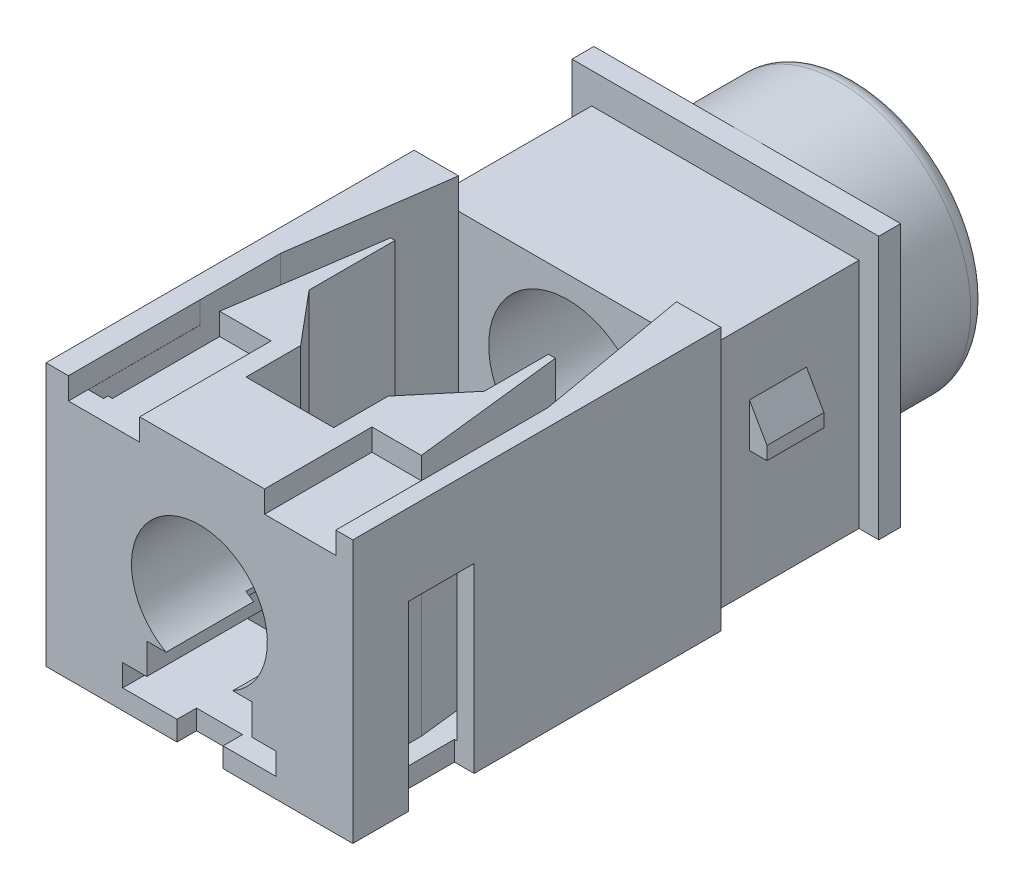
from build123d import *

# Parameters (mm, degrees)
SZKIC1_R                      = 3
SZKIC1_R_2                    = 1.8
DODANIE_WYCI_GNI_CIE1_DEPTH   = 2.5
SZKIC2_W                      = 7
SZKIC2_H                      = 6
SZKIC2_R                      = 1.8
DODANIE_WYCI_GNI_CIE2_DEPTH   = 0.5
ZAOKR_GLENIE1_R               = 0.4
SFAZOWANIE1_SIZE              = 0.4
SZKIC3_W                      = 6.1
SZKIC3_H                      = 5.3
SZKIC3_R                      = 1.8
DODANIE_WYCI_GNI_CIE3_DEPTH   = 3.6
DODANIE_WYCI_GNI_CIE4_START   = -0.1
DODANIE_WYCI_GNI_CIE4_DEPTH   = 1.3
SZKIC5_W                      = 7
SZKIC5_H                      = 6
SZKIC5_R                      = 1.55
DODANIE_WYCI_GNI_CIE5_DEPTH   = 8.4
SZKIC8_R                      = 0.475
DODANIE_WYCI_GNI_CIE6_DEPTH   = 0.8
DODANIE_WYCI_GNI_CIE6_2_DEPTH = 0.8
ZAOKR_GLENIE2_R               = 0.2
ZAOKR_GLENIE3_R               = 0.2
SZKIC9_W                      = 0.85
SZKIC9_H                      = 1.15
WYTNIJ_WYCI_GNI_CIE1_DEPTH    = 0.95
SZKIC10_W                     = 1.05
SZKIC10_H                     = 0.475
WYTNIJ_WYCI_GNI_CIE2_DEPTH    = 2
WYTNIJ_WYCI_GNI_CIE3_DEPTH    = 4.15
WYTNIJ_WYCI_GNI_CIE4_START    = -8.4
WYTNIJ_WYCI_GNI_CIE4_DEPTH    = 8.4
WYTNIJ_WYCI_GNI_CIE5_REACH    = 18.837
SZKIC14_W                     = 1.625
SZKIC14_H                     = 2.45
SZKIC14_H_2                   = 3
WYTNIJ_WYCI_GNI_CIE6_DEPTH    = 0.5


with BuildPart() as part:
    # Szkic1 → Dodanie-wyciągnięcie1 (new body)
    with BuildSketch(Plane.XY):
        Circle(SZKIC1_R)
        Circle(SZKIC1_R_2, mode=Mode.SUBTRACT)
    extrude(amount=DODANIE_WYCI_GNI_CIE1_DEPTH)

    # Szkic2 → Dodanie-wyciągnięcie2 (add)
    with BuildSketch(Plane.XY.offset(2.5)):
        Rectangle(SZKIC2_W, SZKIC2_H)
        Circle(SZKIC2_R, mode=Mode.SUBTRACT)
    extrude(amount=DODANIE_WYCI_GNI_CIE2_DEPTH)

    # Zaokrąglenie1
    zaokr_glenie1_edges = [part.edges().sort_by_distance(p)[0] for p in [
        (-3, 0, 0),
    ]]
    fillet(zaokr_glenie1_edges, radius=ZAOKR_GLENIE1_R)

    # Sfazowanie1
    sfazowanie1_edges = [part.edges().sort_by_distance(p)[0] for p in [
        (-1.8, 0, 0),
    ]]
    chamfer(sfazowanie1_edges, length=SFAZOWANIE1_SIZE)

    # Szkic3 → Dodanie-wyciągnięcie3 (add)
    with BuildSketch(Plane.XY.offset(3)):
        with Locations((0, -0.35)):
            Rectangle(SZKIC3_W, SZKIC3_H)
        Circle(SZKIC3_R, mode=Mode.SUBTRACT)
    extrude(amount=DODANIE_WYCI_GNI_CIE3_DEPTH)


with BuildPart() as body_2:
    # Szkic4 → Dodanie-wyciągnięcie4 (new body)
    with BuildSketch(Plane.XY.offset(4.3).offset(DODANIE_WYCI_GNI_CIE4_START)):
        Polygon((3.05, 0.790431876), (3.05, -0.209568124), (3.45, -0.209568124), (3.45, 0.090431876), align=None)
    extrude(amount=DODANIE_WYCI_GNI_CIE4_DEPTH)


with BuildPart() as body_3:
    # Lustro1: mirrored copy
    add(body_2.part.mirror(Plane(origin=(0, 0, 0), x_dir=(0, 0, 1), z_dir=(1, 0, 0))))


with BuildPart() as body_4:
    # Szkic5 → Dodanie-wyciągnięcie5 (new body)
    with BuildSketch(Plane.XY.offset(6.6)):
        Rectangle(SZKIC5_W, SZKIC5_H)
        Circle(SZKIC5_R, mode=Mode.SUBTRACT)
    extrude(amount=DODANIE_WYCI_GNI_CIE5_DEPTH)

    # Szkic9 → Wytnij-wyciągnięcie1 (cut)
    with BuildSketch(Plane.XZ.offset(3)):
        with Locations((1.325, 11.630923267)):
            Rectangle(SZKIC9_W, SZKIC9_H)
        with Locations((-1.325, 11.630923267)):
            Rectangle(SZKIC9_W, SZKIC9_H)
    extrude(amount=-WYTNIJ_WYCI_GNI_CIE1_DEPTH, mode=Mode.SUBTRACT)

    # Szkic10 → Wytnij-wyciągnięcie2 (cut)
    with BuildSketch(Plane.XZ.offset(3)):
        with Locations((0.015, 14.793423267)):
            Rectangle(SZKIC10_W, SZKIC10_H)
    extrude(amount=-WYTNIJ_WYCI_GNI_CIE2_DEPTH, mode=Mode.SUBTRACT)

    # Szkic11 → Wytnij-wyciągnięcie3 (cut)
    with BuildSketch(Plane.XZ.offset(3)):
        Polygon((3.05, 13.530923267), (2.7, 13.530923267), (2.7, 14.580923267), (3.05, 14.580923267), (3.05, 13.730923267), (3.5, 13.730923267), (3.5, 12.230923267), (3.05, 12.230923267), align=None)
        Polygon((-3.05, 13.530923267), (-3.05, 12.230923267), (-3.5, 12.230923267), (-3.5, 13.730923267), (-3.05, 13.730923267), (-3.05, 14.580923267), (-2.7, 14.580923267), (-2.7, 13.530923267), align=None)
    extrude(amount=-WYTNIJ_WYCI_GNI_CIE3_DEPTH, mode=Mode.SUBTRACT)

    # Szkic12 → Wytnij-wyciągnięcie4 (cut)
    with BuildSketch(Plane.XY.offset(15).offset(WYTNIJ_WYCI_GNI_CIE4_START)):
        with BuildLine():
            Line((1.75, -2.05), (1.75, -2.55))
            Line((1.75, -2.55), (0.54, -2.55))
            Line((0.54, -2.55), (-0.51, -2.55))
            Line((-0.51, -2.55), (-1.75, -2.55))
            Line((-1.75, -2.55), (-1.75, -2.05))
            Line((-1.75, -2.05), (-1.2, -2.05))
            Line((-1.2, -2.05), (-1.2, -1.35))
            Line((-1.2, -1.35), (-0.761577311, -1.35))
            ThreePointArc((-0.761577311, -1.35), (0, 1.55), (0.761577311, -1.35))
            Line((0.761577311, -1.35), (1.2, -1.35))
            Line((1.2, -1.35), (1.2, -2.05))
            Line((1.2, -2.05), (1.75, -2.05))
        make_face()
    extrude(amount=WYTNIJ_WYCI_GNI_CIE4_DEPTH, mode=Mode.SUBTRACT)

    # Wytnij-wyciągnięcie5: up to this face of the body (flat: up to its plane)
    wytnij_wyci_gni_cie5_end = Plane(body_4.part.faces().sort_by_distance((-0.000259249, -2.55, 10.671035346))[0])
    # Szkic13 → Wytnij-wyciągnięcie5 (cut, up to the picked face)
    with BuildSketch(Plane(origin=(0, 3, 0), x_dir=(1, 0, 0), z_dir=(0, 1, 0)), mode=Mode.PRIVATE) as wytnij_wyci_gni_cie5_sk1:
        Polygon((-2.486342085, -6.6), (-2.986342085, -10.157684861), (-2.986342085, -14.55), (-2.636342085, -14.55), (-2.636342085, -14.45), (-2.536342085, -14.45), (-2.536342085, -12), (-2.036342085, -8.6), (-1.936342085, -8.6), (-1.936342085, -10.561649281), (-0.936342085, -11.753402874), (-0.936342085, -13), (1.063657915, -13), (1.063657915, -11.753402874), (2.063657915, -10.561649281), (2.063657915, -9.1), (2.220476097, -9.1), (2.612521551, -12.55), (2.612521551, -14.45), (2.763657915, -14.45), (2.763657915, -14.55), (3.113657915, -14.55), (3.113657915, -10.157684861), (2.486342085, -6.6), align=None)
    wytnij_wyci_gni_cie5_tool1 = split(extrude(wytnij_wyci_gni_cie5_sk1.sketch, amount=-WYTNIJ_WYCI_GNI_CIE5_REACH, mode=Mode.PRIVATE), bisect_by=wytnij_wyci_gni_cie5_end, keep=Keep.BOTH, mode=Mode.PRIVATE)
    add(wytnij_wyci_gni_cie5_tool1.solids().sort_by(Axis((0.074934, 3, 9.686962), (0, -1, 0)))[0], mode=Mode.SUBTRACT)

    # Szkic14 → Wytnij-wyciągnięcie6 (cut)
    with BuildSketch(Plane(origin=(0, 3, 0), x_dir=(1, 0, 0), z_dir=(0, 1, 0))):
        with Locations((2.299282609, -13.775)):
            Rectangle(SZKIC14_W, SZKIC14_H)
        with Locations((-2.175717391, -13.5)):
            Rectangle(SZKIC14_W, SZKIC14_H_2)
    extrude(amount=-WYTNIJ_WYCI_GNI_CIE6_DEPTH, mode=Mode.SUBTRACT)


with BuildPart() as body_5:
    # Szkic8 → Dodanie-wyciągnięcie6 (new body)
    with BuildSketch(Plane.XZ.offset(3)):
        with Locations((0, 11.530923267)):
            Circle(SZKIC8_R)
    extrude(amount=DODANIE_WYCI_GNI_CIE6_DEPTH)

    # Zaokrąglenie3
    zaokr_glenie3_edges = [body_5.edges().sort_by_distance(p)[0] for p in [
        (-0.475, -3.8, 11.530923267),
    ]]
    fillet(zaokr_glenie3_edges, radius=ZAOKR_GLENIE3_R)


with BuildPart() as body_6:
    # Szkic8 → Dodanie-wyci_gni_cie6 2 (new body)
    with BuildSketch(Plane.XZ.offset(3)):
        with Locations((0, 4.530923267)):
            Circle(SZKIC8_R)
    extrude(amount=DODANIE_WYCI_GNI_CIE6_2_DEPTH)

    # Zaokrąglenie2
    zaokr_glenie2_edges = [body_6.edges().sort_by_distance(p)[0] for p in [
        (-0.475, -3.8, 4.530923267),
    ]]
    fillet(zaokr_glenie2_edges, radius=ZAOKR_GLENIE2_R)


solid = Compound([part.part, body_2.part, body_3.part, body_4.part, body_5.part, body_6.part])
